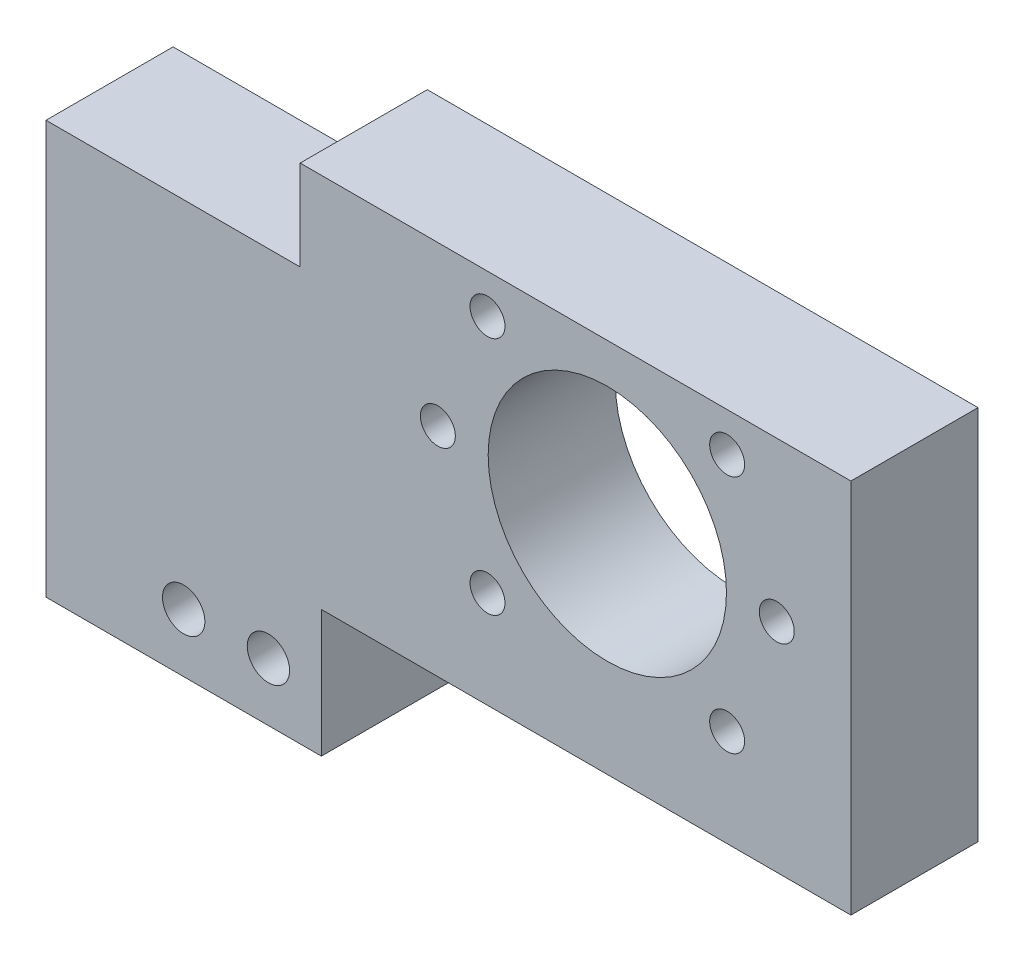
from build123d import *

# Parameters (mm, degrees)
SKETCH_1_W           = 70
SKETCH_1_H           = 30
EXTRUDE_1_DEPTH      = 27
CUT_EXTRUDE_1_DEPTH  = 47.679760068
SKETCH_3_R           = 1.65
CUT_EXTRUDE_2_DEPTH  = 47.679760068
SKETCH_4_W           = 21
SKETCH_4_H           = 8.5
CUT_EXTRUDE_3_DEPTH  = 47.679760068
SKETCH_7_R           = 11.25
CUT_EXTRUDE_5_DEPTH  = 47.679760068
SKETCH_8_W           = 21.5
SKETCH_8_H           = 21.5
EXTRUDE_2_DEPTH      = 8
SKETCH_10_R          = 1.5
CUT_EXTRUDE_6_DEPTH  = 54.422841557
SKETCH_12_W          = 35
SKETCH_12_H          = 21.5
EXTRUDE_3_DEPTH      = 3
SKETCH_13_R          = 3
CUT_EXTRUDE_7_DEPTH  = 15
SKETCH_14_R          = 1.65
EXTRUDE_4_DEPTH      = 27
SKETCH_15_W          = 27
SKETCH_15_H          = 30
EXTRUDE_5_DEPTH      = 3
EXTRUDE_START        = 5.5
SKETCH_16_R          = 3
EXTRUDE_6_DEPTH      = 5.5
SKETCH_22_W          = 26
SKETCH_22_H          = 15
CUT_EXTRUDE_9_DEPTH  = 8
EXTRUDE_START_2      = 8
SKETCH_20_R          = 11.25
EXTRUDE_8_DEPTH      = 8
CUT_EXTRUDE_8_DEPTH  = 8
SKETCH_23_W          = 26
SKETCH_23_H          = 20
EXTRUDE_9_DEPTH      = 17
SKETCH_24_R          = 2
CUT_EXTRUDE_10_DEPTH = 64.837684795
SKETCH_25_R          = 3.75
CUT_EXTRUDE_11_DEPTH = 5
SKETCH_26_R          = 3.1
CUT_EXTRUDE_12_DEPTH = 16
SKETCH_27_R          = 1.25
CUT_EXTRUDE_13_DEPTH = 10
SKETCH_28_W          = 2
SKETCH_28_H          = 12.06571985
CUT_EXTRUDE_14_DEPTH = 16
FILLET_1_R           = 2
SKETCH_29_W          = 20
SKETCH_29_H          = 5
CUT_EXTRUDE_15_DEPTH = 89.945207853
SKETCH_30_W          = 8
SKETCH_30_H          = 47.5
CUT_EXTRUDE_16_DEPTH = 87.955448363
SKETCH_31_W          = 15
SKETCH_31_H          = 35.5
CUT_EXTRUDE_17_DEPTH = 87.955448363


with BuildPart() as part:
    # 草图1 → 凸台-拉伸1 (new body)
    with BuildSketch(Plane.XY):
        Rectangle(SKETCH_1_W, SKETCH_1_H)
    extrude(amount=EXTRUDE_1_DEPTH)

    # 草图2 → 切除-拉伸1 (cut, through all)
    with BuildSketch(Plane.XY.offset(27)):
        with BuildLine():
            Line((28.228756555, -15), (35, -15))
            Line((35, -15), (35, 0))
            ThreePointArc((35, 0), (33.228756555, -8.228756555), (28.228756555, -15))
        make_face()
        with BuildLine():
            ThreePointArc((28.228756555, 15), (33.228756555, 8.228756555), (35, 0))
            Line((35, 0), (35, 15))
            Line((35, 15), (28.228756555, 15))
        make_face()
    extrude(amount=-CUT_EXTRUDE_1_DEPTH, mode=Mode.SUBTRACT)

    # 草图3 → 切除-拉伸2 (cut, through all)
    with BuildSketch(Plane.XY.offset(27)):
        with Locations((31, 0)):
            Circle(SKETCH_3_R)
        with Locations((26.313708499, 11.313708499)):
            Circle(SKETCH_3_R)
        with Locations(Location((26.313708499, -11.313708499, 0), (0, 0, 180))):
            Circle(SKETCH_3_R)
        with Locations(Location((3.686291501, 11.313708499, 0), (0, 0, 180))):
            Circle(SKETCH_3_R)
        with Locations((3.686291501, -11.313708499)):
            Circle(SKETCH_3_R)
        with Locations((-1, 0)):
            Circle(SKETCH_3_R)
    extrude(amount=-CUT_EXTRUDE_2_DEPTH, mode=Mode.SUBTRACT)

    # 草图4 → 切除-拉伸3 (cut, through all)
    with BuildSketch(Plane.XY.offset(27)):
        with Locations((-24.5, 10.75)):
            Rectangle(SKETCH_4_W, SKETCH_4_H)
    extrude(amount=-CUT_EXTRUDE_3_DEPTH, mode=Mode.SUBTRACT)

    # 草图7 → 切除-拉伸5 (cut, through all)
    with BuildSketch(Plane(origin=(0, 0, 0), x_dir=(-1, 0, 0), z_dir=(0, 0, -1))):
        with Locations((-15, 0)):
            Circle(SKETCH_7_R)
    extrude(amount=-CUT_EXTRUDE_5_DEPTH, mode=Mode.SUBTRACT)

    # 草图8 → 凸台-拉伸2 (add)
    with BuildSketch(Plane(origin=(0, 0, 0), x_dir=(-1, 0, 0), z_dir=(0, 0, -1))):
        with Locations((24.25, -4.25)):
            Rectangle(SKETCH_8_W, SKETCH_8_H)
    extrude(amount=EXTRUDE_2_DEPTH)

    # 草图10 → 切除-拉伸6 (cut, through all)
    with BuildSketch(Plane.XZ.offset(15)):
        with Locations(Location((-17.5, 19.95, 0), (0, 0, 270))):
            Circle(SKETCH_10_R)
        with Locations(Location((-32.5, 19.95, 0), (0, 0, 270))):
            Circle(SKETCH_10_R)
    extrude(amount=-CUT_EXTRUDE_6_DEPTH, mode=Mode.SUBTRACT)

    # 草图12 → 凸台-拉伸3 (add)
    with BuildSketch(Plane.ZY.offset(35)):
        with Locations((9.5, -4.25)):
            Rectangle(SKETCH_12_W, SKETCH_12_H)
    extrude(amount=EXTRUDE_3_DEPTH)

    # 草图13 → 切除-拉伸7 (cut)
    with BuildSketch(Plane.XZ.offset(15)):
        with Locations(Location((-32.5, 19.95, 0), (0, 0, 270))):
            Circle(SKETCH_13_R)
        with Locations(Location((-17.5, 19.95, 0), (0, 0, 270))):
            Circle(SKETCH_13_R)
    extrude(amount=-CUT_EXTRUDE_7_DEPTH, mode=Mode.SUBTRACT)

    # 草图14 → 凸台-拉伸4 (add)
    with BuildSketch(Plane.XY.offset(27)):
        Polygon((28.228756555, -15), (35, -15), (35, 0), (35, 15), (28.228756555, 15), (28.228756555, 12.920752662), (28.228756555, 9.706664336), (28.228756555, 0), (28.228756555, -9.706664336), (28.228756555, -12.920752662), align=None)
        with Locations((31, 0)):
            Circle(SKETCH_14_R, mode=Mode.SUBTRACT)
    extrude(amount=-EXTRUDE_4_DEPTH)

    # 草图15 → 凸台-拉伸5 (add)
    with BuildSketch(Plane(origin=(35, 0, 0), x_dir=(0, 0, -1), z_dir=(1, 0, 0))):
        with Locations((-13.5, 0)):
            Rectangle(SKETCH_15_W, SKETCH_15_H)
    extrude(amount=EXTRUDE_5_DEPTH)

    # 草图16 → 凸台-拉伸6 (add)
    with BuildSketch(Plane.XZ.offset(15).offset(EXTRUDE_START)):
        Polygon((-13.5, 0), (38, 0), (38, 27), (-38, 27), (-38, -8), (-13.5, -8), align=None)
        with Locations(Location((-32.5, 19.95, 0), (0, 0, 270))):
            Circle(SKETCH_16_R, mode=Mode.SUBTRACT)
        with Locations(Location((-17.5, 19.95, 0), (0, 0, 270))):
            Circle(SKETCH_16_R, mode=Mode.SUBTRACT)
    extrude(amount=-EXTRUDE_6_DEPTH)

    # 草图22 → 切除-拉伸9 (cut)
    with BuildSketch(Plane.XZ.offset(20.5)):
        with Locations((-25, 19.5)):
            Rectangle(SKETCH_22_W, SKETCH_22_H)
    extrude(amount=-CUT_EXTRUDE_9_DEPTH, mode=Mode.SUBTRACT)

    # 草图20 → 凸台-拉伸8 (add)
    with BuildSketch(Plane(origin=(0, 0, 0), x_dir=(-1, 0, 0), z_dir=(0, 0, -1)).offset(EXTRUDE_START_2)):
        Polygon((14, 15), (-38, 15), (-38, -20.5), (13.5, -20.5), (13.5, 6.5), (14, 6.5), align=None)
        with Locations((-15, 0)):
            Circle(SKETCH_20_R, mode=Mode.SUBTRACT)
    extrude(amount=-EXTRUDE_8_DEPTH)

    # 草图21 → 切除-拉伸8 (cut)
    with BuildSketch(Plane(origin=(0, 0, -8), x_dir=(-1, 0, 0), z_dir=(0, 0, -1))):
        with BuildLine():
            Line((-27.816005618, -16), (-2.183994382, -16))
            ThreePointArc((-2.183994382, -16), (-15, 20.5), (-27.816005618, -16))
        make_face()
    extrude(amount=-CUT_EXTRUDE_8_DEPTH, mode=Mode.SUBTRACT)

    # 草图23 → 凸台-拉伸9 (add)
    with BuildSketch(Plane.XZ.offset(20.5)):
        with Locations((-25, 2)):
            Rectangle(SKETCH_23_W, SKETCH_23_H)
    extrude(amount=EXTRUDE_9_DEPTH)

    # 草图24 → 切除-拉伸10 (cut, through all)
    with BuildSketch(Plane(origin=(0, 0, -8), x_dir=(-1, 0, 0), z_dir=(0, 0, -1))):
        with Locations((17, -27)):
            Circle(SKETCH_24_R)
        with Locations((25, -27)):
            Circle(SKETCH_24_R)
    extrude(amount=-CUT_EXTRUDE_10_DEPTH, mode=Mode.SUBTRACT)

    # 草图25 → 切除-拉伸11 (cut)
    with BuildSketch(Plane(origin=(0, 0, -8), x_dir=(-1, 0, 0), z_dir=(0, 0, -1))):
        with Locations((17, -27)):
            Circle(SKETCH_25_R)
        with Locations((25, -27)):
            Circle(SKETCH_25_R)
    extrude(amount=-CUT_EXTRUDE_11_DEPTH, mode=Mode.SUBTRACT)

    # 草图26 → 切除-拉伸12 (cut)
    with BuildSketch(Plane.XZ.offset(37.5)):
        with Locations(Location((-31, 7, 0), (0, 0, 270))):
            Circle(SKETCH_26_R)
    extrude(amount=-CUT_EXTRUDE_12_DEPTH, mode=Mode.SUBTRACT)

    # 草图27 → 切除-拉伸13 (cut)
    with BuildSketch(Plane.XZ.offset(21.5)):
        with Locations(Location((-31, 7, 0), (0, 0, 270))):
            Circle(SKETCH_27_R)
    extrude(amount=-CUT_EXTRUDE_13_DEPTH, mode=Mode.SUBTRACT)

    # 草图28 → 切除-拉伸14 (cut)
    with BuildSketch(Plane.XZ.offset(37.5)):
        with Locations((-31, -1.967140075)):
            Rectangle(SKETCH_28_W, SKETCH_28_H)
    extrude(amount=-CUT_EXTRUDE_14_DEPTH, mode=Mode.SUBTRACT)

    # 圆角1
    fillet_1_edges = [part.edges().sort_by_distance(p)[0] for p in [
        (-32, -29.5, 4.06571985),
        (-30, -29.5, 4.06571985),
    ]]
    fillet(fillet_1_edges, radius=FILLET_1_R)

    # 草图29 → 切除-拉伸15 (cut, through all)
    with BuildSketch(Plane.ZY.offset(38)):
        with Locations((2, -35)):
            Rectangle(SKETCH_29_W, SKETCH_29_H)
    extrude(amount=-CUT_EXTRUDE_15_DEPTH, mode=Mode.SUBTRACT)

    # 草图30 → 切除-拉伸16 (cut, through all)
    with BuildSketch(Plane(origin=(38, 0, 0), x_dir=(0, 0, -1), z_dir=(1, 0, 0))):
        with Locations((4, -8.75)):
            Rectangle(SKETCH_30_W, SKETCH_30_H)
    extrude(amount=-CUT_EXTRUDE_16_DEPTH, mode=Mode.SUBTRACT)

    # 草图31 → 切除-拉伸17 (cut, through all)
    with BuildSketch(Plane.ZY.offset(38)):
        with Locations((19.5, -2.75)):
            Rectangle(SKETCH_31_W, SKETCH_31_H)
    extrude(amount=-CUT_EXTRUDE_17_DEPTH, mode=Mode.SUBTRACT)


solid = part.part
